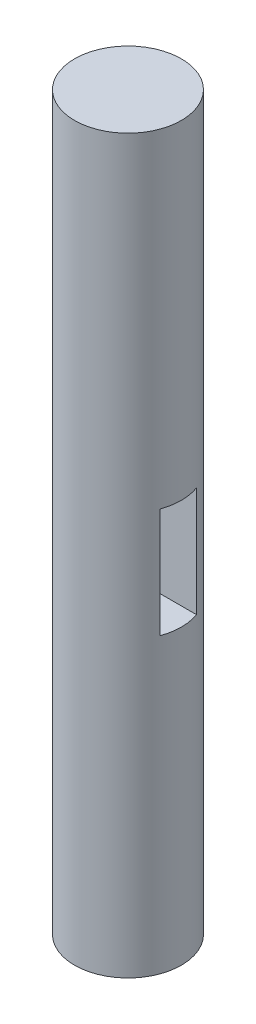
from build123d import *

# Parameters (mm, degrees)
SKETCH1_R               = 9.271
BOSS_EXTRUDE1_DEPTH     = 127
CUT_EXTRUDE1_DEPTH      = 128.674989258
CUT_EXTRUDE1_DEPTH_BACK = 128.674989258
SKETCH2_W               = 6.35
SKETCH2_H               = 19.05


with BuildPart() as part:
    # Sketch1 → Boss-Extrude1 (new body)
    with BuildSketch(Plane(origin=(0, 0, 0), x_dir=(1, 0, 0), z_dir=(0, 1, 0))):
        with Locations(Location((0, 0, 0), (0, 0, 270))):
            Circle(SKETCH1_R)
    extrude(amount=BOSS_EXTRUDE1_DEPTH)

    # Sketch2 → Cut-Extrude1 (cut, two sides: drawn at the far end of the back side and taken through both)
    with BuildSketch(Plane(origin=(0, 0, 0), x_dir=(0, 0, -1), z_dir=(1, 0, 0)).offset(-CUT_EXTRUDE1_DEPTH_BACK)):
        with Locations((0, 60.36564)):
            Rectangle(SKETCH2_W, SKETCH2_H)
    extrude(amount=CUT_EXTRUDE1_DEPTH + CUT_EXTRUDE1_DEPTH_BACK, mode=Mode.SUBTRACT)


solid = part.part
